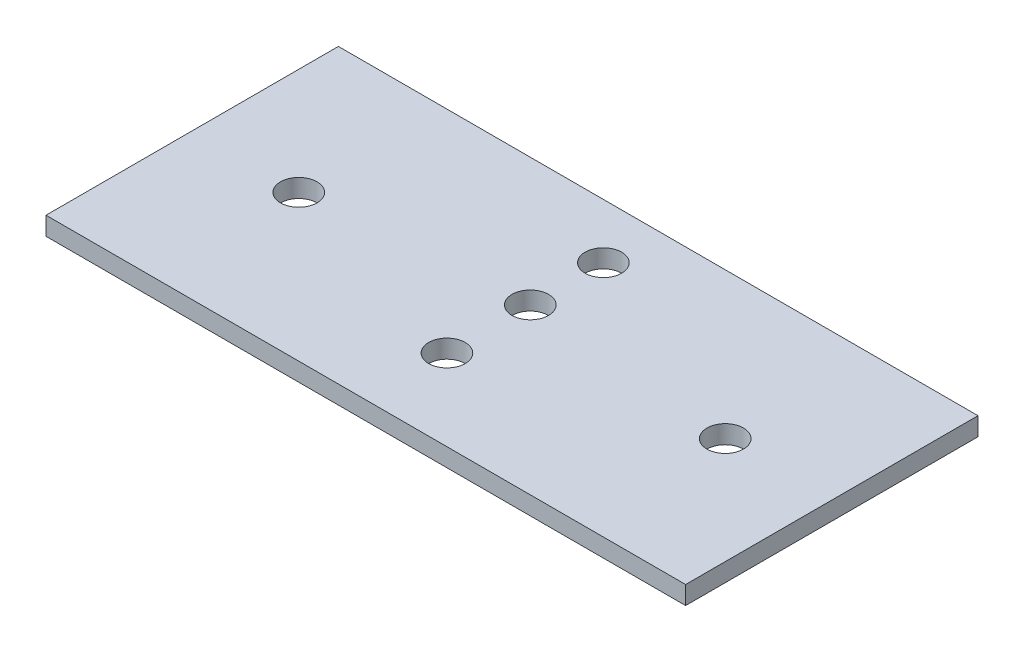
from build123d import *

# Parameters (mm, degrees)
BOSS_EXTRUDE1_DEPTH      = 35
BOSS_EXTRUDE1_DEPTH_BACK = 35
SKETCH1_W                = 32
SKETCH1_H                = 2
SKETCH2_R                = 2
CUT_EXTRUDE2_DEPTH       = 2
SKETCH3_R                = 2
CUT_EXTRUDE3_DEPTH       = 2


with BuildPart() as part:
    # Sketch1 → Boss-Extrude1 (new, two sides: drawn at the far end of the back side and taken through both)
    with BuildSketch(Plane(origin=(0, 0, 0), x_dir=(0, 0, -1), z_dir=(1, 0, 0)).offset(-BOSS_EXTRUDE1_DEPTH_BACK)):
        with Locations((0, 1)):
            Rectangle(SKETCH1_W, SKETCH1_H)
    extrude(amount=BOSS_EXTRUDE1_DEPTH + BOSS_EXTRUDE1_DEPTH_BACK)

    # Sketch2 → Cut-Extrude2 (cut)
    with BuildSketch(Plane(origin=(0, 2, 0), x_dir=(1, 0, 0), z_dir=(0, 1, 0))):
        with Locations(Location((-23.335, 0, 0), (0, 0, 270))):
            Circle(SKETCH2_R)
        with Locations(Location((23.335, 0, 0), (0, 0, 270))):
            Circle(SKETCH2_R)
    extrude(amount=-CUT_EXTRUDE2_DEPTH, mode=Mode.SUBTRACT)

    # Sketch3 → Cut-Extrude3 (cut)
    with BuildSketch(Plane(origin=(0, 2, 0), x_dir=(1, 0, 0), z_dir=(0, 1, 0))):
        with Locations(Location((0, 10, 0), (0, 0, 270))):
            Circle(SKETCH3_R)
        with Locations(Location((0, 2, 0), (0, 0, 270))):
            Circle(SKETCH3_R)
        with Locations(Location((0, -7.12, 0), (0, 0, 270))):
            Circle(SKETCH3_R)
    extrude(amount=-CUT_EXTRUDE3_DEPTH, mode=Mode.SUBTRACT)


solid = part.part
